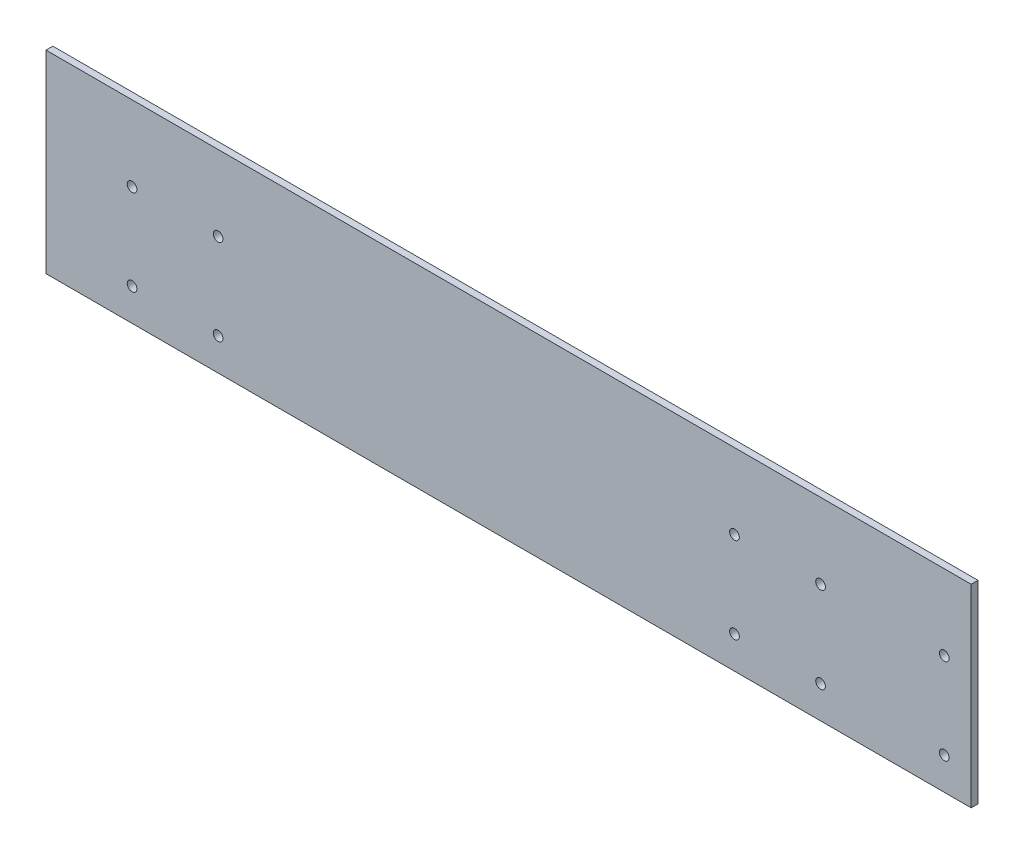
from build123d import *

# Parameters (mm, degrees)
SKETCH3_W            = 430
SKETCH3_H            = 90
BOSS_EXTRUDE1_DEPTH  = 3.175
M4_CLEARANCE_HOLE1_D = 4.5


with BuildPart() as part:
    # Sketch3 → Boss-Extrude1 (new body)
    with BuildSketch(Plane.XY):
        Rectangle(SKETCH3_W, SKETCH3_H)
    extrude(amount=BOSS_EXTRUDE1_DEPTH)

    # M4 Clearance Hole1 (through all)
    with Locations(Plane.XY.offset(3.175)):
        with Locations((-135, 10), (-175, -30), (-175, 10), (-135, -30), (145, 10), (105, -30), (105, 10), (145, -30), (202.5, 10), (202.5, -30)):
            Hole(M4_CLEARANCE_HOLE1_D / 2)


solid = part.part
